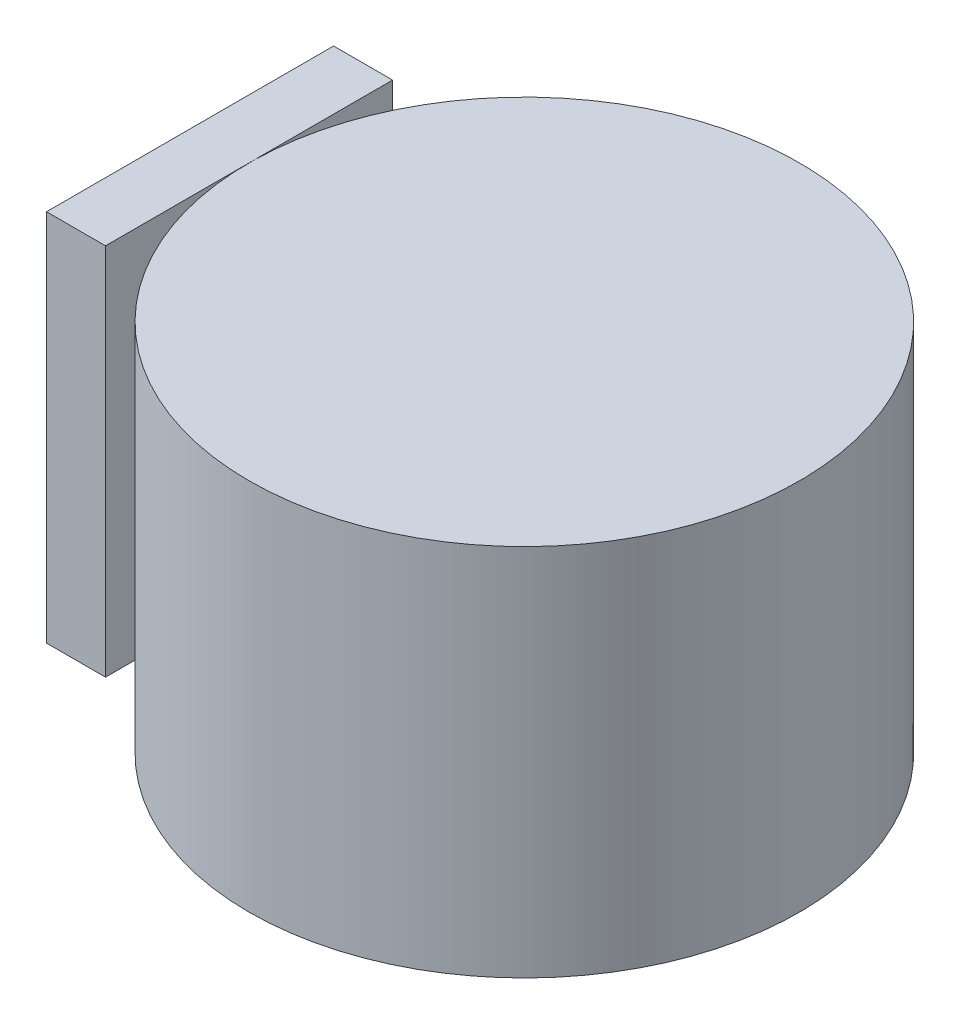
from build123d import *

# Parameters (mm, degrees)
SKETCH_1_R           = 14
EXTRUDE_1_DEPTH      = 19
EXTRUDE_2_DEPTH      = 7.3
EXTRUDE_2_DEPTH_BACK = 7.3
SKETCH_3_W           = 3
SKETCH_3_H           = 19


with BuildPart() as part:
    # 草图1 → 凸台-拉伸1 (new body)
    with BuildSketch(Plane(origin=(0, 0, 0), x_dir=(1, 0, 0), z_dir=(0, 1, 0))):
        Circle(SKETCH_1_R)
    extrude(amount=EXTRUDE_1_DEPTH)


with BuildPart() as body_2:
    # 草图3 → 凸台-拉伸2 (new, two sides: drawn at the far end of the back side and taken through both)
    with BuildSketch(Plane.XY.offset(-EXTRUDE_2_DEPTH_BACK)):
        with Locations((-15.5, 9.5)):
            Rectangle(SKETCH_3_W, SKETCH_3_H)
    extrude(amount=EXTRUDE_2_DEPTH + EXTRUDE_2_DEPTH_BACK)


solid = Compound([part.part, body_2.part])
